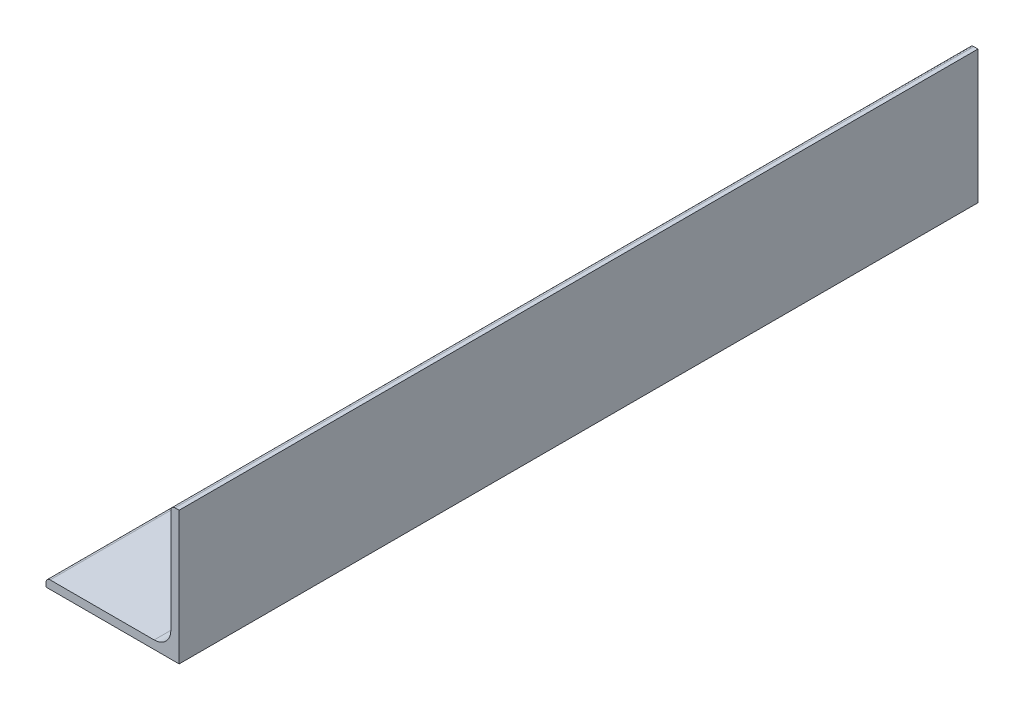
from build123d import *

# Parameters (mm, degrees)
BOSS_EXTRUDE1_DEPTH = 152.4


with BuildPart() as part:
    # Sketch2 → Boss-Extrude1 (new, symmetric)
    with BuildSketch(Plane.XY):
        with BuildLine():
            Line((-25.4, -25.4), (25.4, -25.4))
            Line((25.4, -25.4), (25.4, 25.4))
            Line((25.4, 25.4), (23.8125, 25.4))
            ThreePointArc((23.8125, 25.4), (22.689967985, 24.935032015), (22.225, 23.8125))
            Line((22.225, 23.8125), (22.225, -15.875))
            ThreePointArc((22.225, -15.875), (20.365128061, -20.365128061), (15.875, -22.225))
            Line((15.875, -22.225), (-23.8125, -22.225))
            ThreePointArc((-23.8125, -22.225), (-24.935032015, -22.689967985), (-25.4, -23.8125))
            Line((-25.4, -23.8125), (-25.4, -25.4))
        make_face()
    extrude(amount=BOSS_EXTRUDE1_DEPTH, both=True)


solid = part.part
